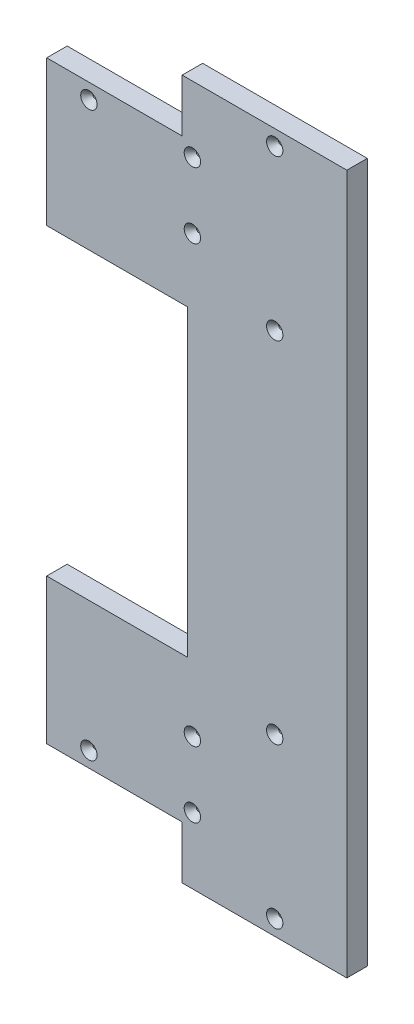
from build123d import *

# Parameters (mm, degrees)
SKETCH1_W           = 243.588796282
SKETCH1_H           = 434.599999988
BOSS_EXTRUDE1_DEPTH = 12.7
CUT_EXTRUDE1_REACH  = 273.182
SKETCH2_W           = 141.287862113
SKETCH2_H           = 32.775
CUT_EXTRUDE2_REACH  = 273.182
HOLE1_D             = 3.175
HOLE1_DEPTH         = 38.1
HOLE1_CSINK_D       = 10.16
HOLE1_CSINK_ANGLE   = 82
HOLE1_TIP           = 0.953866233
CUT_EXTRUDE3_REACH  = 273.182
SKETCH6_W           = 31.75
SKETCH6_H           = 90.274999997


with BuildPart() as part:
    # Sketch1 → Boss-Extrude1 (new body)
    with BuildSketch(Plane.XY):
        with Locations((39.942597436, 0)):
            Rectangle(SKETCH1_W, SKETCH1_H)
    extrude(amount=BOSS_EXTRUDE1_DEPTH)

    # Sketch2 → Cut-Extrude1 (cut, up to next)
    with BuildSketch(Plane(origin=(0, 0, 0), x_dir=(-1, 0, 0), z_dir=(0, 0, -1)), mode=Mode.PRIVATE) as cut_extrude1_sk1:
        with Locations((11.207869649, 200.912499994)):
            Rectangle(SKETCH2_W, SKETCH2_H)
    cut_extrude1_tool1 = extrude(cut_extrude1_sk1.sketch, amount=-CUT_EXTRUDE1_REACH, mode=Mode.PRIVATE) & part.part
    # Sketch2 → Cut-Extrude1 (cut, up to next)
    with BuildSketch(Plane(origin=(0, 0, 0), x_dir=(-1, 0, 0), z_dir=(0, 0, -1)), mode=Mode.PRIVATE) as cut_extrude1_sk2:
        with Locations((11.207869649, -200.912499994)):
            Rectangle(SKETCH2_W, SKETCH2_H)
    cut_extrude1_tool2 = extrude(cut_extrude1_sk2.sketch, amount=-CUT_EXTRUDE1_REACH, mode=Mode.PRIVATE) & part.part
    add(cut_extrude1_tool1.solids().sort_by_distance((-11.20787, 200.9125, 0))[0], mode=Mode.SUBTRACT)
    add(cut_extrude1_tool2.solids().sort_by_distance((-11.20787, -200.9125, 0))[0], mode=Mode.SUBTRACT)

    # Sketch3 → Cut-Extrude2 (cut, up to next)
    with BuildSketch(Plane.XY.offset(12.7), mode=Mode.PRIVATE) as cut_extrude2_sk1:
        Polygon((62.611061408, 94.249999997), (-56.451800705, 94.249999997), (-56.451800705, 184.524999994), (-81.851800705, 184.524999994), (-81.851800705, 94.249999997), (-85.026800705, 94.249999997), (-85.026800705, -94.249999997), (-81.851800705, -94.249999997), (-81.851800705, -184.524999994), (-56.451800705, -184.524999994), (-56.451800705, -94.249999997), (62.611061408, -94.249999997), align=None)
    cut_extrude2_tool1 = extrude(cut_extrude2_sk1.sketch, amount=-CUT_EXTRUDE2_REACH, mode=Mode.PRIVATE) & part.part
    add(cut_extrude2_tool1.solids().sort_by_distance((-19.405412, 0, 12.7))[0], mode=Mode.SUBTRACT)

    # Hole1
    with Locations(Plane(origin=(449.828463103, 0, 12.7), x_dir=(0, 1, 0), z_dir=(0, 0, 1))):
        with Locations((-108.649999997, 332.89193461), (108.649999997, 332.89193461), (207.774999994, 332.89193461), (174.999999994, 448.336332751), (135.266666663, 384.042401694), (176.283333328, 384.042401694), (-174.999999994, 448.336332751), (-135.266666663, 384.042401694), (-176.283333328, 384.042401694), (-207.774999994, 332.89193461)):
            CounterSinkHole(HOLE1_D / 2, HOLE1_CSINK_D / 2, depth=HOLE1_DEPTH, counter_sink_angle=HOLE1_CSINK_ANGLE)
            with Locations((0, 0, -(HOLE1_DEPTH + HOLE1_TIP / 2))):  # 118° drill point
                Cone(0, HOLE1_D / 2, HOLE1_TIP, mode=Mode.SUBTRACT)

    # Sketch6 → Cut-Extrude3 (cut, up to next)
    with BuildSketch(Plane.XY.offset(12.7), mode=Mode.PRIVATE) as cut_extrude3_sk1:
        with Locations((-40.576800705, 139.387499996)):
            Rectangle(SKETCH6_W, SKETCH6_H)
    cut_extrude3_tool1 = extrude(cut_extrude3_sk1.sketch, amount=-CUT_EXTRUDE3_REACH, mode=Mode.PRIVATE) & part.part
    # Sketch6 → Cut-Extrude3 (cut, up to next)
    with BuildSketch(Plane.XY.offset(12.7), mode=Mode.PRIVATE) as cut_extrude3_sk2:
        with Locations((-40.576800705, -139.387499996)):
            Rectangle(SKETCH6_W, SKETCH6_H)
    cut_extrude3_tool2 = extrude(cut_extrude3_sk2.sketch, amount=-CUT_EXTRUDE3_REACH, mode=Mode.PRIVATE) & part.part
    add(cut_extrude3_tool1.solids().sort_by_distance((-40.576801, 139.3875, 12.7))[0], mode=Mode.SUBTRACT)
    add(cut_extrude3_tool2.solids().sort_by_distance((-40.576801, -139.3875, 12.7))[0], mode=Mode.SUBTRACT)


solid = part.part
